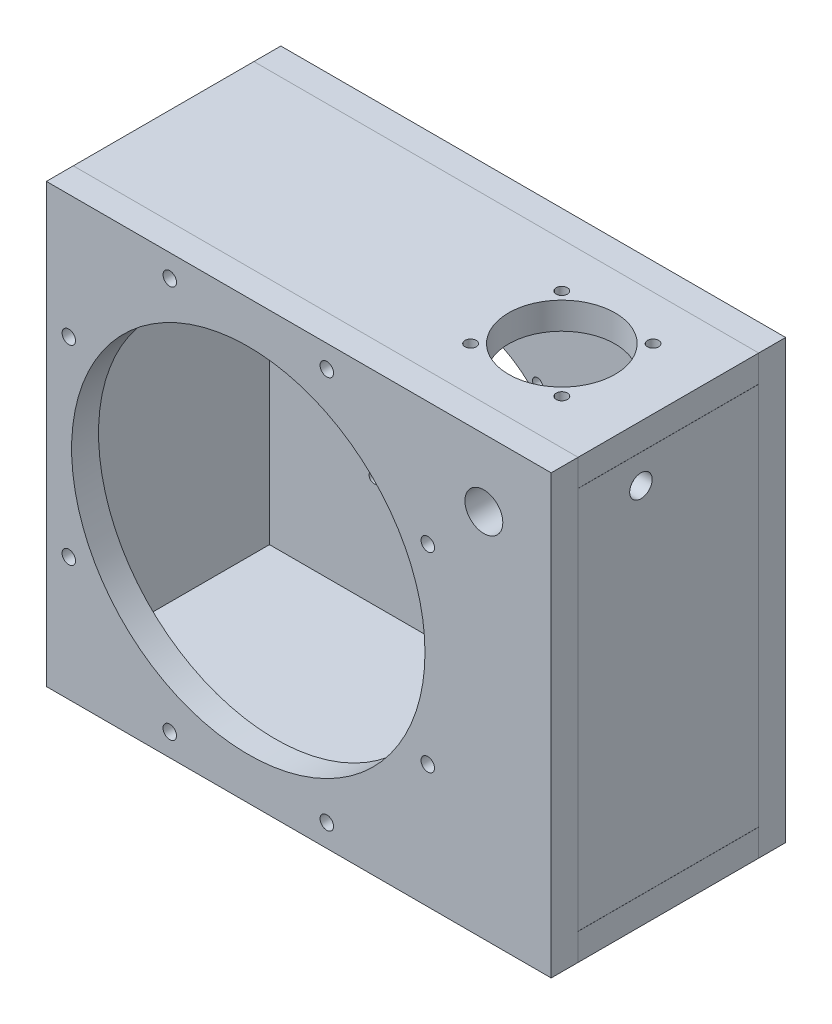
from build123d import *

# Parameters (mm, degrees)
SKETCH_1_W               = 450
SKETCH_1_H               = 390
EXTRUDE_1_DEPTH          = 24
SKETCH_2_W               = 450
SKETCH_2_H               = 390
SKETCH_2_W_2             = 402
SKETCH_2_H_2             = 342
EXTRUDE_2_DEPTH          = 161
SKETCH_3_W               = 450
SKETCH_3_H               = 390
EXTRUDE_3_DEPTH          = 24
SKETCH_6_R               = 95
CUT_EXTRUDE_3_DEPTH      = 33
SKETCH_4_R               = 157.5
CUT_EXTRUDE_5_DEPTH      = 43
SKETCH_5_R               = 47.5
CUT_EXTRUDE_6_DEPTH      = 43
SKETCH_10_R              = 5
CUT_EXTRUDE_7_DEPTH      = 18
SKETCH_11_W              = 161
SKETCH_11_H              = 0.1
CUT_EXTRUDE_8_DEPTH      = 632.09508
SKETCH_12_R              = 47.5
CUT_EXTRUDE_9_DEPTH      = 40.2
SKETCH_13_R              = 5
CUT_EXTRUDE_10_DEPTH     = 18
SKETCH_14_W              = 10
SKETCH_14_H              = 341.9
CUT_EXTRUDE_12_DEPTH     = 161
SKETCH_17_R              = 4
CUT_EXTRUDE_14_DEPTH     = 20
SKETCH_19_R              = 8
CUT_EXTRUDE_18_DEPTH     = 20
SKETCH_20_R              = 6
CUT_EXTRUDE_19_DEPTH     = 20
SKETCH_21_R              = 10
CUT_EXTRUDE_20_DEPTH     = 35
SKETCH_22_R              = 16.875
CUT_EXTRUDE_21_DEPTH     = 40
SKETCH_23_R              = 4.5
CUT_EXTRUDE_22_DEPTH     = 632.09508
PATTERN_CIRCULAR_1_COUNT = 16


with BuildPart() as part:
    # 草图1 → 拉伸1 (new body)
    with BuildSketch(Plane.XY):
        with Locations((225, -195)):
            Rectangle(SKETCH_1_W, SKETCH_1_H)
    extrude(amount=EXTRUDE_1_DEPTH)

    # 草图6 → 切除-拉伸3 (cut)
    with BuildSketch(Plane(origin=(0, 0, 0), x_dir=(-1, 0, 0), z_dir=(0, 0, -1))):
        with Locations((-180, -195)):
            Circle(SKETCH_6_R)
    extrude(amount=-CUT_EXTRUDE_3_DEPTH, mode=Mode.SUBTRACT)


with BuildPart() as body_2:
    # 草图2 → 拉伸2 (new body)
    with BuildSketch(Plane.XY.offset(24)):
        with Locations((225, -195)):
            Rectangle(SKETCH_2_W, SKETCH_2_H)
        with Locations((225, -195)):
            Rectangle(SKETCH_2_W_2, SKETCH_2_H_2, mode=Mode.SUBTRACT)
    extrude(amount=EXTRUDE_2_DEPTH)

    # 草图5 → 切除-拉伸6 (cut)
    with BuildSketch(Plane.XZ.offset(390)):
        with Locations(Location((355, 104.5, 0), (0, 0, 270))):
            Circle(SKETCH_5_R)
    extrude(amount=-CUT_EXTRUDE_6_DEPTH, mode=Mode.SUBTRACT)

    # 草图10 → 切除-拉伸7 (cut)
    with BuildSketch(Plane.XZ.offset(390)):
        with Locations(Location((395.658639918, 145.158639918, 0), (0, 0, 270))):
            Circle(SKETCH_10_R)
        with Locations(Location((395.658639918, 63.841360082, 0), (0, 0, 270))):
            Circle(SKETCH_10_R)
        with Locations(Location((314.341360082, 63.841360082, 0), (0, 0, 270))):
            Circle(SKETCH_10_R)
        with Locations(Location((314.341360082, 145.158639918, 0), (0, 0, 270))):
            Circle(SKETCH_10_R)
    extrude(amount=-CUT_EXTRUDE_7_DEPTH, mode=Mode.SUBTRACT)

    # 草图11 → 切除-拉伸8 (cut, through all)
    with BuildSketch(Plane.ZY):
        with Locations((104.5, -24.05)):
            Rectangle(SKETCH_11_W, SKETCH_11_H)
        with Locations((104.5, -365.95)):
            Rectangle(SKETCH_11_W, SKETCH_11_H)
    extrude(amount=-CUT_EXTRUDE_8_DEPTH, mode=Mode.SUBTRACT)


with BuildPart() as body_3:
    # 草图3 → 拉伸3 (new body)
    with BuildSketch(Plane.XY.offset(185)):
        with Locations((225, -195)):
            Rectangle(SKETCH_3_W, SKETCH_3_H)
    extrude(amount=EXTRUDE_3_DEPTH)

    # 草图4 → 切除-拉伸5 (cut)
    with BuildSketch(Plane.XY.offset(209)):
        with Locations((180, -195)):
            Circle(SKETCH_4_R)
    extrude(amount=-CUT_EXTRUDE_5_DEPTH, mode=Mode.SUBTRACT)


with BuildPart() as cut_extrude_8_piece_1:
    # of the separate pieces the step leaves, piece 1, a body of its own (cut_extrude_8_pieces)
    add(body_2.part.solids().sort_by_distance((0, 0, 24))[0])

    # 草图12 → 切除-拉伸9 (cut)
    with BuildSketch(Plane(origin=(0, 0, 0), x_dir=(1, 0, 0), z_dir=(0, 1, 0))):
        with Locations(Location((355, -104.5, 0), (0, 0, 90))):
            Circle(SKETCH_12_R)
    extrude(amount=-CUT_EXTRUDE_9_DEPTH, mode=Mode.SUBTRACT)

    # 草图13 → 切除-拉伸10 (cut)
    with BuildSketch(Plane(origin=(0, 0, 0), x_dir=(1, 0, 0), z_dir=(0, 1, 0))):
        with Locations(Location((395.658639918, -145.158639918, 0), (0, 0, 90))):
            Circle(SKETCH_13_R)
        with Locations(Location((314.341360082, -145.158639918, 0), (0, 0, 90))):
            Circle(SKETCH_13_R)
        with Locations(Location((395.658639918, -63.841360082, 0), (0, 0, 90))):
            Circle(SKETCH_13_R)
        with Locations(Location((314.341360082, -63.841360082, 0), (0, 0, 90))):
            Circle(SKETCH_13_R)
    extrude(amount=-CUT_EXTRUDE_10_DEPTH, mode=Mode.SUBTRACT)


with BuildPart() as cut_extrude_8_piece_2:
    # of the separate pieces the step leaves, piece 2, a body of its own (cut_extrude_8_pieces)
    add(body_2.part.solids().sort_by_distance((0, -390, 24))[0])


with BuildPart() as cut_extrude_8_piece_3:
    # of the separate pieces the step leaves, piece 3, a body of its own (cut_extrude_8_pieces)
    add(body_2.part.solids().sort_by_distance((450, -24.1, 24))[0])


with BuildPart() as cut_extrude_8_piece_4:
    # of the separate pieces the step leaves, piece 4, a body of its own (cut_extrude_8_pieces)
    add(body_2.part.solids().sort_by_distance((0, -365.9, 24))[0])


with BuildPart() as cut_extrude_12_tool:
    # 草图14 → 切除-拉伸12 (new body)
    with BuildSketch(Plane(origin=(0, 0, 24), x_dir=(-1, 0, 0), z_dir=(0, 0, -1))):
        with Locations((-19, -195.05)):
            Rectangle(SKETCH_14_W, SKETCH_14_H)
        with Locations((-431, -195.05)):
            Rectangle(SKETCH_14_W, SKETCH_14_H)
    extrude(amount=-CUT_EXTRUDE_12_DEPTH)


with BuildPart() as cut_extrude_8_piece_3_1:
    add(cut_extrude_8_piece_3.part)

    # 切除-拉伸12: cut by cut_extrude_12_tool
    add(cut_extrude_12_tool.part, mode=Mode.SUBTRACT)

    # 草图21 → 切除-拉伸20 (cut)
    with BuildSketch(Plane(origin=(450, 0, 0), x_dir=(0, 0, -1), z_dir=(1, 0, 0))):
        with Locations((-129, -50)):
            Circle(SKETCH_21_R)
    extrude(amount=-CUT_EXTRUDE_20_DEPTH, mode=Mode.SUBTRACT)


with BuildPart() as cut_extrude_8_piece_4_1:
    add(cut_extrude_8_piece_4.part)

    # 切除-拉伸12: cut by cut_extrude_12_tool
    add(cut_extrude_12_tool.part, mode=Mode.SUBTRACT)


with BuildPart() as cut_extrude_14_tool:
    # 草图17 → 切除-拉伸14 (new body)
    with BuildSketch(Plane.XZ.offset(390)):
        with Locations(Location((70, 194.5, 0), (0, 0, 270))):
            Circle(SKETCH_17_R)
        with Locations(Location((200, 194.5, 0), (0, 0, 270))):
            Circle(SKETCH_17_R)
        with Locations(Location((70, 14.5, 0), (0, 0, 270))):
            Circle(SKETCH_17_R)
        with Locations(Location((200, 14.5, 0), (0, 0, 270))):
            Circle(SKETCH_17_R)
    extrude(amount=-CUT_EXTRUDE_14_DEPTH)


with BuildPart() as part_1:
    add(part.part)

    # 切除-拉伸14: cut by cut_extrude_14_tool
    add(cut_extrude_14_tool.part, mode=Mode.SUBTRACT)

    # 草图19 → 切除-拉伸18 (cut)
    with BuildSketch(Plane(origin=(0, 0, 0), x_dir=(-1, 0, 0), z_dir=(0, 0, -1))):
        with Locations((-400, -15)):
            Circle(SKETCH_19_R)
        with Locations((-225, -15)):
            Circle(SKETCH_19_R)
        with Locations((-50, -15)):
            Circle(SKETCH_19_R)
        with Locations((-400, -375)):
            Circle(SKETCH_19_R)
        with Locations((-225, -375)):
            Circle(SKETCH_19_R)
        with Locations((-50, -375)):
            Circle(SKETCH_19_R)
    extrude(amount=-CUT_EXTRUDE_18_DEPTH, mode=Mode.SUBTRACT)

    # 草图23 → 切除-拉伸22 (cut, through all)
    with BuildSketch(Plane(origin=(0, 0, 0), x_dir=(-1, 0, 0), z_dir=(0, 0, -1))):
        with Locations((-283, -195)):
            Circle(SKETCH_23_R)
    cut_extrude_22 = extrude(amount=-CUT_EXTRUDE_22_DEPTH, mode=Mode.SUBTRACT)

    # 阵列(圆周)1: 切除-拉伸22 ×16 about axis
    pattern_circular_1_axis = Axis((180, -195, 0), (0, 0, 1))
    for i in range(1, PATTERN_CIRCULAR_1_COUNT):
        add(cut_extrude_22.rotate(pattern_circular_1_axis, i * 360 / PATTERN_CIRCULAR_1_COUNT), mode=Mode.SUBTRACT)


with BuildPart() as body_3_1:
    add(body_3.part)

    # 切除-拉伸14: cut by cut_extrude_14_tool
    add(cut_extrude_14_tool.part, mode=Mode.SUBTRACT)

    # 草图20 → 切除-拉伸19 (cut)
    with BuildSketch(Plane.XY.offset(209)):
        with Locations((110, -20)):
            Circle(SKETCH_20_R)
        with Locations((250, -20)):
            Circle(SKETCH_20_R)
        with Locations((110, -370)):
            Circle(SKETCH_20_R)
        with Locations((250, -370)):
            Circle(SKETCH_20_R)
        with Locations((20, -110)):
            Circle(SKETCH_20_R)
        with Locations((340, -110)):
            Circle(SKETCH_20_R)
        with Locations((20, -280)):
            Circle(SKETCH_20_R)
        with Locations((340, -280)):
            Circle(SKETCH_20_R)
    extrude(amount=-CUT_EXTRUDE_19_DEPTH, mode=Mode.SUBTRACT)

    # 草图22 → 切除-拉伸21 (cut)
    with BuildSketch(Plane.XY.offset(209)):
        with Locations((390, -60)):
            Circle(SKETCH_22_R)
    extrude(amount=-CUT_EXTRUDE_21_DEPTH, mode=Mode.SUBTRACT)


solid = Compound([cut_extrude_8_piece_1.part, cut_extrude_8_piece_2.part, cut_extrude_8_piece_3_1.part, cut_extrude_8_piece_4_1.part, part_1.part, body_3_1.part])
